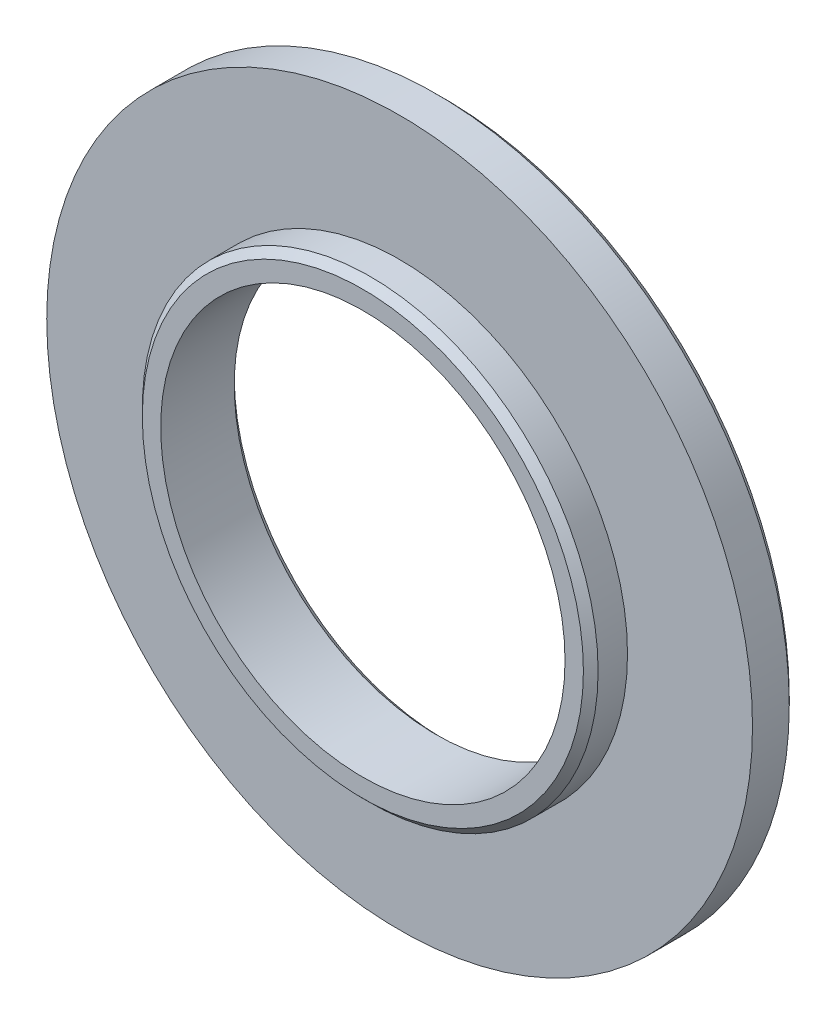
from build123d import *

# Parameters (mm, degrees)
SCHIZZO1_R        = 48
ESTRUSIONE1_DEPTH = 6
SCHIZZO2_R        = 31
ESTRUSIONE2_DEPTH = 5
SMUSSO1_SIZE      = 1
SCHIZZO3_R        = 27.5
ESTRUSIONE3_DEPTH = 69.767724988
SMUSSO2_SIZE      = 1


with BuildPart() as part:
    # Schizzo1 → Estrusione1 (new body)
    with BuildSketch(Plane.XY):
        Circle(SCHIZZO1_R)
    extrude(amount=ESTRUSIONE1_DEPTH)

    # Schizzo2 → Estrusione2 (add)
    with BuildSketch(Plane.XY.offset(6)):
        Circle(SCHIZZO2_R)
    extrude(amount=ESTRUSIONE2_DEPTH)

    # Smusso1
    smusso1_edges = [part.edges().sort_by_distance(p)[0] for p in [
        (-48, 0, 0),
        (-31, 0, 11),
    ]]
    chamfer(smusso1_edges, length=SMUSSO1_SIZE)

    # Schizzo3 → Estrusione3 (cut, through all)
    with BuildSketch(Plane.XY.offset(11)):
        Circle(SCHIZZO3_R)
    extrude(amount=-ESTRUSIONE3_DEPTH, mode=Mode.SUBTRACT)

    # Smusso2
    smusso2_edges = [part.edges().sort_by_distance(p)[0] for p in [
        (-27.5, 0, 0),
    ]]
    chamfer(smusso2_edges, length=SMUSSO2_SIZE)


solid = part.part
